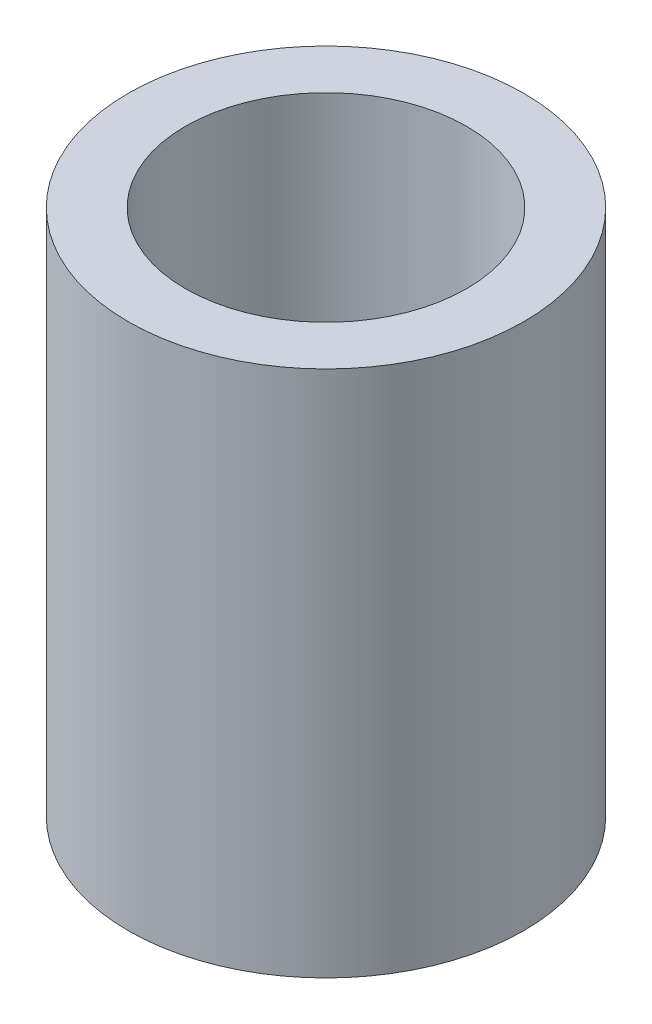
from build123d import *

# Parameters (mm, degrees)
SKETCH1_R           = 2.25
SKETCH1_R_2         = 1.6
BOSS_EXTRUDE1_DEPTH = 6


with BuildPart() as part:
    # Sketch1 → Boss-Extrude1 (new body)
    with BuildSketch(Plane(origin=(0, 0, 0), x_dir=(1, 0, 0), z_dir=(0, 1, 0))):
        with Locations(Location((0, 0, 0), (0, 0, 270))):
            Circle(SKETCH1_R)
        with Locations(Location((0, 0, 0), (0, 0, 270))):
            Circle(SKETCH1_R_2, mode=Mode.SUBTRACT)
    extrude(amount=BOSS_EXTRUDE1_DEPTH)


solid = part.part
